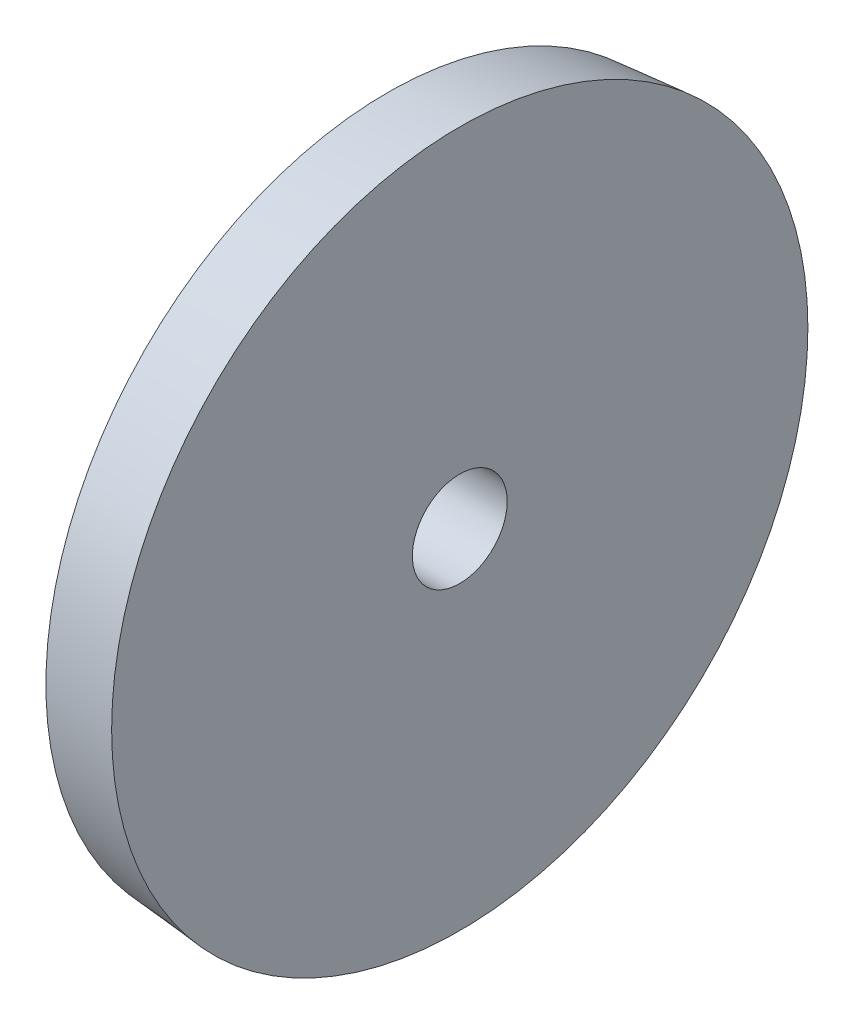
from build123d import *


with BuildPart() as part:
    # Sketch2 → Revolve1 (revolve)
    with BuildSketch(Plane(origin=(0, 0, 0), x_dir=(0, 1, 0), z_dir=(0, 0, 1)), mode=Mode.PRIVATE) as revolve1_sk:
        Polygon((5.0165, 0), (36.83, 0), (36.163336384, 7.62), (5.0165, 7.62), align=None)
    revolve(revolve1_sk.sketch.rotate(Axis((0, 0, 0), (-1, 0, 0)), 90), axis=Axis((0, 0, 0), (-1, 0, 0)))


solid = part.part
